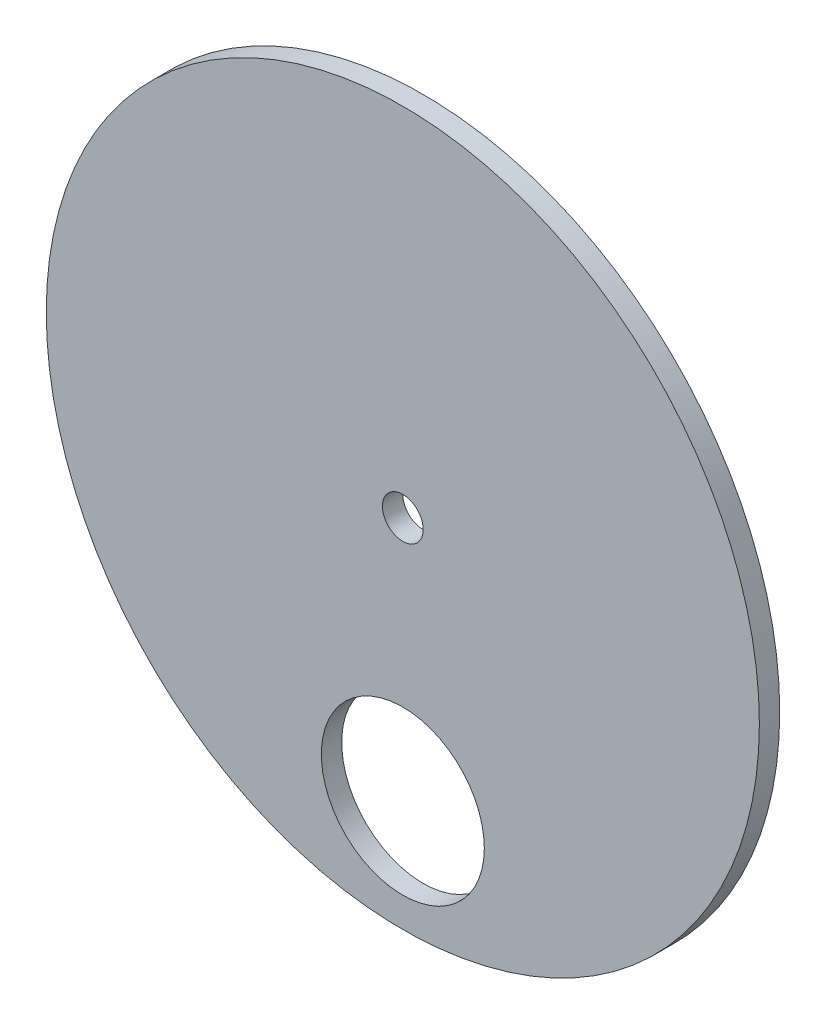
from build123d import *

# Parameters (mm, degrees)
SKETCH1_R           = 175
SKETCH1_R_2         = 40
SKETCH1_R_3         = 10
BOSS_EXTRUDE3_DEPTH = 10


with BuildPart() as part:
    # Sketch1 → Boss-Extrude3 (new body)
    with BuildSketch(Plane.XY):
        Circle(SKETCH1_R)
        with Locations((0, -120.390309949)):
            Circle(SKETCH1_R_2, mode=Mode.SUBTRACT)
        Circle(SKETCH1_R_3, mode=Mode.SUBTRACT)
    extrude(amount=BOSS_EXTRUDE3_DEPTH)


solid = part.part
